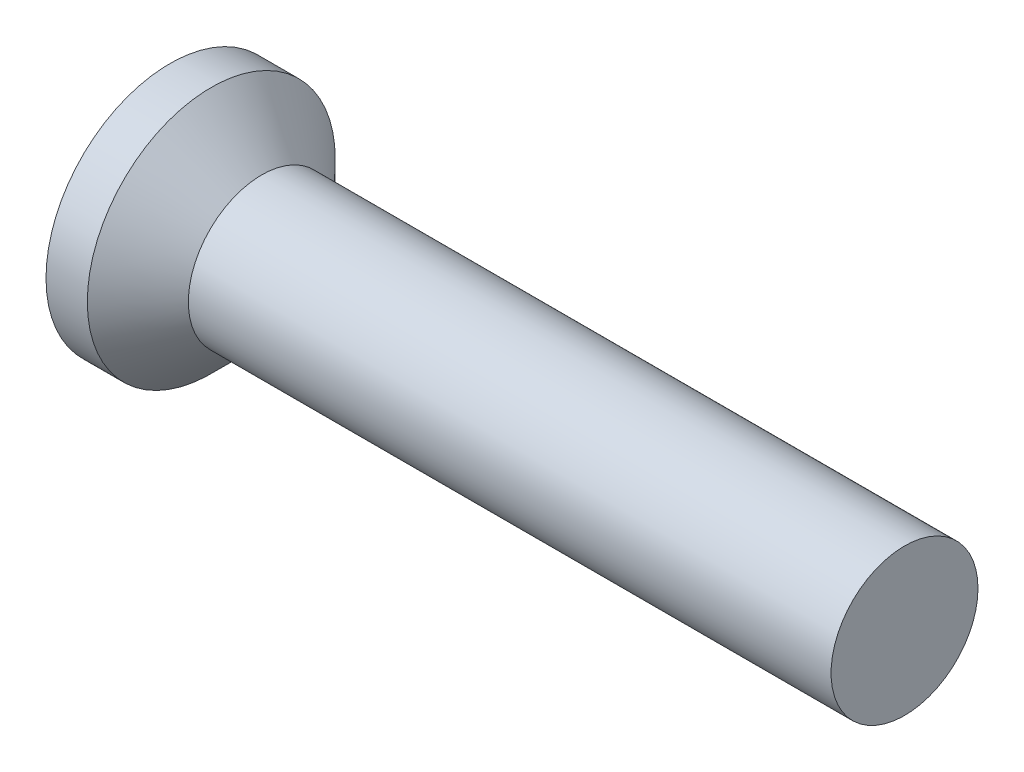
from build123d import *

# Parameters (mm, degrees)
CROSSRECESS_DEPTH = 0.5
DRAFT9_ANGLE      = 30
FILLET5_R         = 0.3


with BuildPart() as part:
    # Sketch1 → Base (revolve)
    with BuildSketch(Plane.XY, mode=Mode.PRIVATE) as base_sk:
        Polygon((8, 0.8), (1.7, 0.8), (1, 0.8), (0.45, 1.35), (0, 1.35), (0, 0), (8, 0), align=None)
    revolve(base_sk.sketch.rotate(Axis((4.515812911, 0, 0), (-1, 0, 0)), 90), axis=Axis((4.515812911, 0, 0), (-1, 0, 0)))

    # Sketch6 → CrossRecess (cut)
    with BuildSketch(Plane(origin=(0, 0, 0), x_dir=(0, 0, -1), z_dir=(1, 0, 0))):
        Polygon((0.16, 0.16), (0.16, 0.8), (-0.16, 0.8), (-0.16, 0.16), (-0.8, 0.16), (-0.8, -0.16), (-0.16, -0.16), (-0.16, -0.8), (0.16, -0.8), (0.16, -0.16), (0.8, -0.16), (0.8, 0.16), align=None)
    extrude(amount=CROSSRECESS_DEPTH, mode=Mode.SUBTRACT)

    # Draft9
    draft9_faces = [part.faces().sort_by_distance(p)[0] for p in [
        (0.25, 0.8, 0),
        (0.25, 0, 0.8),
        (0.25, -0.8, 0),
        (0.25, 0, -0.8),
    ]]
    draft(draft9_faces, Plane(origin=(0, 1.35, 0), x_dir=(0, 0, -1), z_dir=(-1, 0, 0)), DRAFT9_ANGLE)

    # Fillet5
    fillet5_edges = [part.edges().sort_by_distance(p)[0] for p in [
        (0.25, 0.16, 0.16),
        (0.25, -0.16, 0.16),
        (0.25, -0.16, -0.16),
        (0.25, 0.16, -0.16),
    ]]
    fillet(fillet5_edges, radius=FILLET5_R)


solid = part.part
